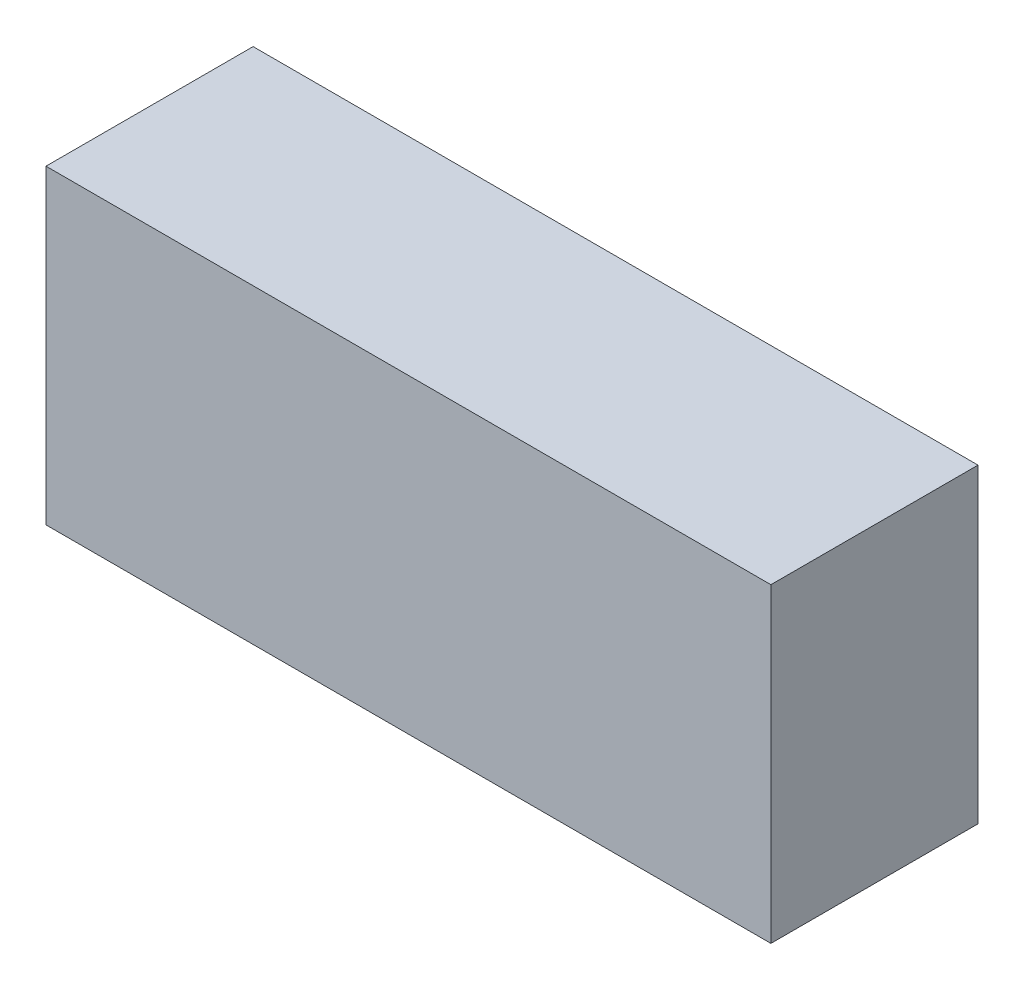
from build123d import *

# Parameters (mm, degrees)
ESQUISSE1_W        = 70
ESQUISSE1_H        = 30
BOSS_EXTRU_1_DEPTH = 20


with BuildPart() as part:
    # Esquisse1 → Boss.-Extru.1 (new body)
    with BuildSketch(Plane.XY):
        with Locations((35, 15)):
            Rectangle(ESQUISSE1_W, ESQUISSE1_H)
    extrude(amount=BOSS_EXTRU_1_DEPTH)


solid = part.part
